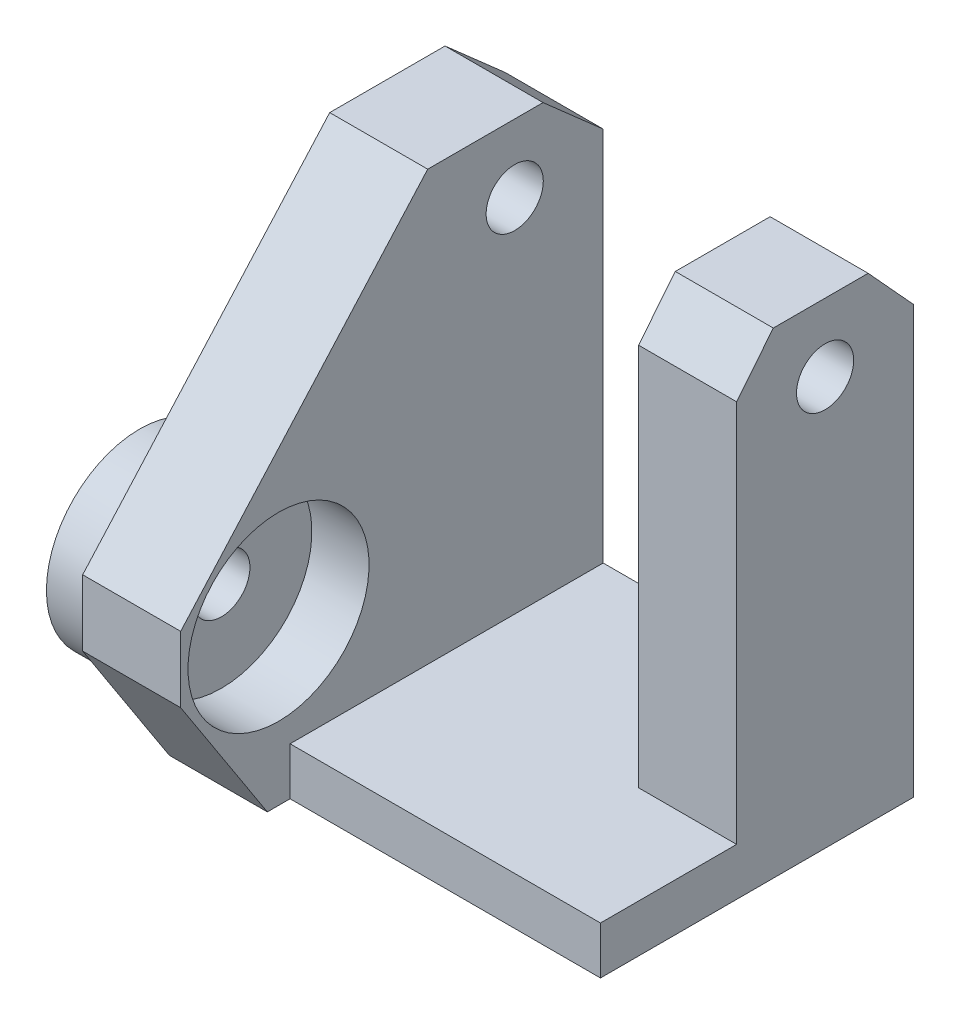
from build123d import *

# Parameters (mm, degrees)
EXTRUDE_3_DEPTH     = 13
SKETCH_5_R          = 2.1
CUT_EXTRUDE_2_DEPTH = 48.895720059
SKETCH_6_W          = 7.2
SKETCH_6_H          = 35
EXTRUDE_4_DEPTH     = 20
SKETCH_7_R          = 2.1
CUT_EXTRUDE_3_DEPTH = 20
SKETCH_8_W          = 22.8
SKETCH_8_H          = 3.5
EXTRUDE_5_DEPTH     = 10
SKETCH_9_R          = 6.65
CUT_EXTRUDE_4_DEPTH = 4.2
CUT_EXTRUDE_5_DEPTH = 10
CUT_EXTRUDE_6_DEPTH = 10
SKETCH_14_R         = 6.85
SKETCH_14_R_2       = 5.65
EXTRUDE_7_DEPTH     = 3


with BuildPart() as part:
    # 草图4 → 凸台-拉伸3 (new body)
    with BuildSketch(Plane.XY):
        Polygon((15, 0), (-15, 0), (-15, 35), (-7.8, 35), (-7.8, 3.5), (7.8, 3.5), (7.8, 35), (15, 35), align=None)
    extrude(amount=EXTRUDE_3_DEPTH)

    # 草图5 → 切除-拉伸2 (cut, through all)
    with BuildSketch(Plane(origin=(15, 0, 0), x_dir=(0, 0, -1), z_dir=(1, 0, 0))):
        with Locations(Location((-6.5, 30, 0), (0, 0, 90))):
            Circle(SKETCH_5_R)
    extrude(amount=-CUT_EXTRUDE_2_DEPTH, mode=Mode.SUBTRACT)

    # 草图6 → 凸台-拉伸4 (add)
    with BuildSketch(Plane.XY.offset(13)):
        with Locations((-11.4, 17.5)):
            Rectangle(SKETCH_6_W, SKETCH_6_H)
    extrude(amount=EXTRUDE_4_DEPTH)

    # 草图7 → 切除-拉伸3 (cut)
    with BuildSketch(Plane.ZY.offset(15)):
        with Locations(Location((23.849351573, 12, 0), (0, 0, 270))):
            Circle(SKETCH_7_R)
    extrude(amount=-CUT_EXTRUDE_3_DEPTH, mode=Mode.SUBTRACT)

    # 草图8 → 凸台-拉伸5 (add)
    with BuildSketch(Plane.XY.offset(13)):
        with Locations((3.6, 1.75)):
            Rectangle(SKETCH_8_W, SKETCH_8_H)
    extrude(amount=EXTRUDE_5_DEPTH)

    # 草图9 → 切除-拉伸4 (cut)
    with BuildSketch(Plane(origin=(-7.8, 0, 0), x_dir=(0, 0, -1), z_dir=(1, 0, 0))):
        with Locations(Location((-23.849351573, 12, 0), (0, 0, 90))):
            Circle(SKETCH_9_R)
    extrude(amount=-CUT_EXTRUDE_4_DEPTH, mode=Mode.SUBTRACT)

    # 草图10 → 切除-拉伸5 (cut)
    with BuildSketch(Plane.ZY.offset(15)):
        Polygon((12.890771142, 35), (31.03620252, 14.67169088), (31.03620252, 9.814342957), (24.670130024, 0), (33, 0), (33, 10.134215088), (33, 35), align=None)
        Polygon((0, 35), (0, 31.107929111), (4.419316467, 35), align=None)
    extrude(amount=-CUT_EXTRUDE_5_DEPTH, mode=Mode.SUBTRACT)

    # 草图11 → 切除-拉伸6 (cut)
    with BuildSketch(Plane(origin=(15, 0, 0), x_dir=(0, 0, -1), z_dir=(1, 0, 0))):
        Polygon((-3.336766509, 35), (0, 31.348169844), (0, 35), align=None)
        Polygon((-10.303751585, 35), (-13, 35), (-13, 31.657050955), align=None)
    extrude(amount=-CUT_EXTRUDE_6_DEPTH, mode=Mode.SUBTRACT)

    # 草图14 → 凸台-拉伸7 (add)
    with BuildSketch(Plane.ZY.offset(15)):
        with Locations(Location((23.849351573, 12, 0), (0, 0, 180))):
            Circle(SKETCH_14_R)
        with Locations((23.849351573, 12)):
            Circle(SKETCH_14_R_2, mode=Mode.SUBTRACT)
    extrude(amount=EXTRUDE_7_DEPTH)


solid = part.part
